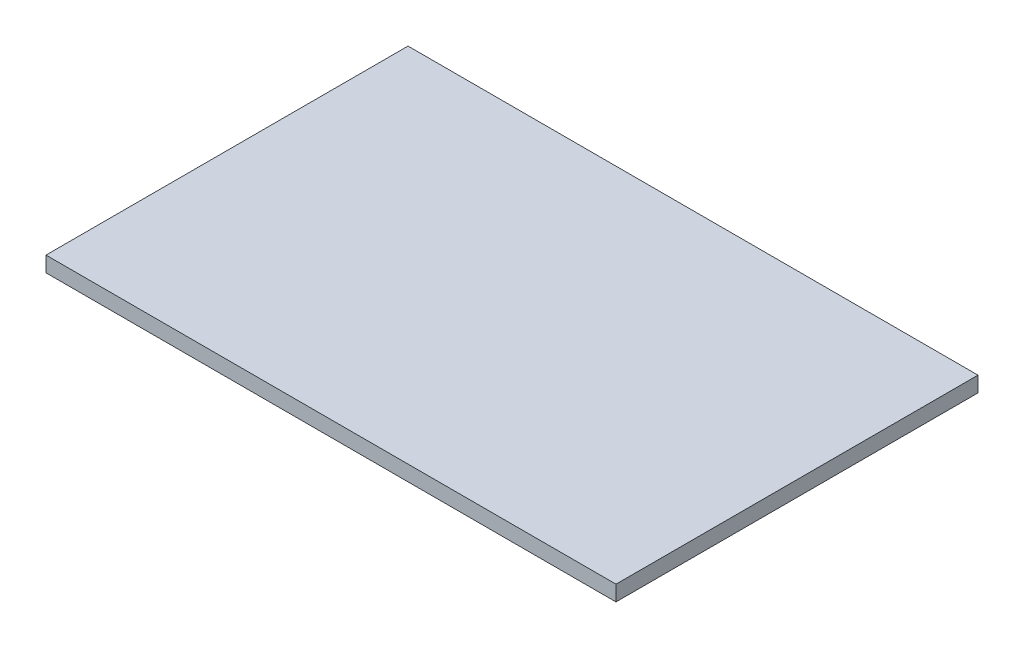
from build123d import *

# Parameters (mm, degrees)
SKETCH2_W           = 740
SKETCH2_H           = 470
BOSS_EXTRUDE1_DEPTH = 20


with BuildPart() as part:
    # Sketch2 → Boss-Extrude1 (new body)
    with BuildSketch(Plane(origin=(0, 0, 0), x_dir=(1, 0, 0), z_dir=(0, 1, 0))):
        Rectangle(SKETCH2_W, SKETCH2_H)
    extrude(amount=BOSS_EXTRUDE1_DEPTH)


solid = part.part
